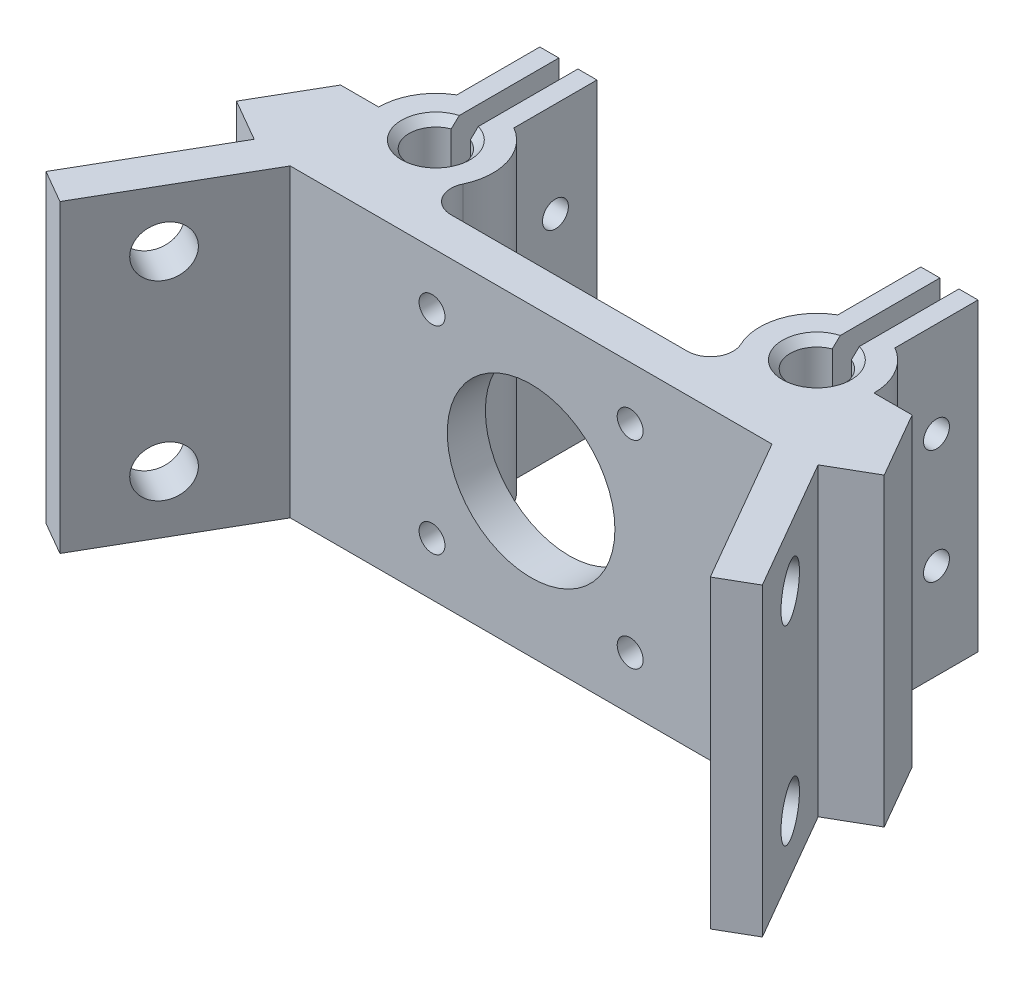
from build123d import *

# Parameters (mm, degrees)
BOSS_EXTRUDE1_DEPTH = 40
SKETCH2_R           = 1.7
CUT_EXTRUDE1_DEPTH  = 28.75
SKETCH4_R           = 1.7
SKETCH4_R_2         = 11
CUT_EXTRUDE2_DEPTH  = 20
CHAMFER1_SIZE       = 1
CUT_EXTRUDE3_REACH  = 159.067
SKETCH5_R           = 3.3


with BuildPart() as part:
    # Sketch1 → Boss-Extrude1 (new body)
    with BuildSketch(Plane(origin=(0, 0, 0), x_dir=(1, 0, 0), z_dir=(0, 1, 0))):
        with BuildLine():
            Line((23.75, 120.769174208), (23.75, 134.895099729))
            Line((23.75, 134.895099729), (21.25, 134.895099729))
            Line((21.25, 134.895099729), (21.25, 123.995190528))
            ThreePointArc((21.25, 123.995190528), (17.839743095, 119.73175291), (18.223690728, 114.285714286))
            ThreePointArc((18.223690728, 114.285714286), (18.048629784, 111.396432549), (15.513167019, 110))
            Line((15.513167019, 110), (-15.513167019, 110))
            ThreePointArc((-15.513167019, 110), (-18.048629784, 111.396432549), (-18.223690728, 114.285714286))
            ThreePointArc((-18.223690728, 114.285714286), (-17.839743095, 119.73175291), (-21.25, 123.995190528))
            Line((-21.25, 123.995190528), (-21.25, 134.895099729))
            Line((-21.25, 134.895099729), (-23.75, 134.895099729))
            Line((-23.75, 134.895099729), (-23.75, 120.769174208))
            ThreePointArc((-23.75, 120.769174208), (-25, 114), (-26.25, 120.769174208))
            Line((-26.25, 120.769174208), (-26.25, 134.895099729))
            Line((-26.25, 134.895099729), (-28.75, 134.895099729))
            Line((-28.75, 134.895099729), (-28.75, 123.995190528))
            ThreePointArc((-28.75, 123.995190528), (-31.495190528, 121.25), (-32.5, 117.5))
            Line((-32.5, 117.5), (-37.5, 117.5))
            Line((-37.5, 117.5), (-42.5, 108.839745962))
            Line((-42.5, 108.839745962), (-37.000738686, 105.664745962))
            Line((-37.000738686, 105.664745962), (-47.000738686, 88.344237886))
            Line((-47.000738686, 88.344237886), (-42.670611667, 85.844237886))
            Line((-42.670611667, 85.844237886), (-31.611027254, 105))
            Line((-31.611027254, 105), (31.611027254, 105))
            Line((31.611027254, 105), (42.670611667, 85.844237886))
            Line((42.670611667, 85.844237886), (47.000738686, 88.344237886))
            Line((47.000738686, 88.344237886), (37.000738686, 105.664745962))
            Line((37.000738686, 105.664745962), (42.5, 108.839745962))
            Line((42.5, 108.839745962), (37.5, 117.5))
            Line((37.5, 117.5), (32.5, 117.5))
            ThreePointArc((32.5, 117.5), (31.495190528, 121.25), (28.75, 123.995190528))
            Line((28.75, 123.995190528), (28.75, 134.895099729))
            Line((28.75, 134.895099729), (26.25, 134.895099729))
            Line((26.25, 134.895099729), (26.25, 120.769174208))
            ThreePointArc((26.25, 120.769174208), (25, 114), (23.75, 120.769174208))
        make_face()
    extrude(amount=BOSS_EXTRUDE1_DEPTH)

    # Sketch2 → Cut-Extrude1 (cut, symmetric)
    with BuildSketch(Plane(origin=(0, 0, 0), x_dir=(0, 0, -1), z_dir=(1, 0, 0))):
        with Locations((129.445145129, 27.5)):
            Circle(SKETCH2_R)
        with Locations(Location((129.445145129, 12.5, 0), (0, 0, 180))):
            Circle(SKETCH2_R)
    extrude(amount=CUT_EXTRUDE1_DEPTH, both=True, mode=Mode.SUBTRACT)

    # Sketch4 → Cut-Extrude2 (cut)
    with BuildSketch(Plane.XY.offset(-105)):
        with Locations((-13, 33)):
            Circle(SKETCH4_R)
        with Locations((0, 20)):
            Circle(SKETCH4_R_2)
        with Locations((13, 33)):
            Circle(SKETCH4_R)
        with Locations((13, 7)):
            Circle(SKETCH4_R)
        with Locations((-13, 7)):
            Circle(SKETCH4_R)
    extrude(amount=-CUT_EXTRUDE2_DEPTH, mode=Mode.SUBTRACT)

    # Chamfer1
    chamfer1_edges = [part.edges().sort_by_distance(p)[0] for p in [
        (25, 40, -114),
        (-25, 40, -114),
    ]]
    chamfer(chamfer1_edges, length=CHAMFER1_SIZE)

    # Sketch5 → Cut-Extrude3 (cut, up to next)
    with BuildSketch(Plane(origin=(-73.504731158, 0, -42.437976321), x_dir=(-0.49999999999998673, 0, 0.8660254037844464), z_dir=(-0.8660254037844464, 0, -0.49999999999998673)), mode=Mode.PRIVATE) as cut_extrude3_sk1:
        with Locations((-63.007984945, 32.5)):
            Circle(SKETCH5_R)
    cut_extrude3_tool1 = extrude(cut_extrude3_sk1.sketch, amount=-CUT_EXTRUDE3_REACH, mode=Mode.PRIVATE) & part.part
    # Sketch5 → Cut-Extrude3 (cut, up to next)
    with BuildSketch(Plane(origin=(-73.504731158, 0, -42.437976321), x_dir=(-0.49999999999998673, 0, 0.8660254037844464), z_dir=(-0.8660254037844464, 0, -0.49999999999998673)), mode=Mode.PRIVATE) as cut_extrude3_sk2:
        with Locations((-63.007984945, 7.5)):
            Circle(SKETCH5_R)
    cut_extrude3_tool2 = extrude(cut_extrude3_sk2.sketch, amount=-CUT_EXTRUDE3_REACH, mode=Mode.PRIVATE) & part.part
    cut_extrude3_1 = cut_extrude3_tool1.solids().sort_by_distance((-42.000739, 32.5, -97.004492))[0]
    add(cut_extrude3_1, mode=Mode.SUBTRACT)
    cut_extrude3_2 = cut_extrude3_tool2.solids().sort_by_distance((-42.000739, 7.5, -97.004492))[0]
    add(cut_extrude3_2, mode=Mode.SUBTRACT)
    cut_extrude3 = cut_extrude3_1 + cut_extrude3_2  # Cut-Extrude3 as one shape, for the pattern or mirror that repeats it

    # Mirror1: Cut-Extrude3 across plane
    add(cut_extrude3.mirror(Plane(origin=(0, 0, 0), x_dir=(0, 0, 1), z_dir=(1, 0, 0))), mode=Mode.SUBTRACT)


solid = part.part
